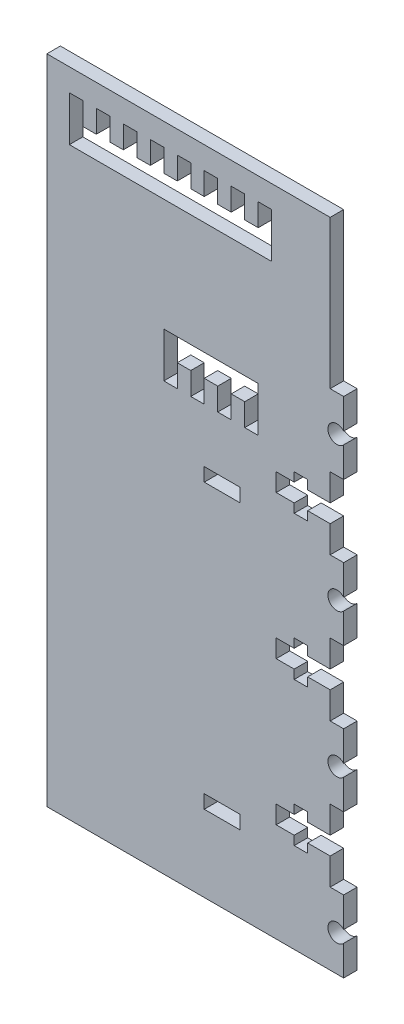
from build123d import *

# Parameters (mm, degrees)
SKETCH_1_W      = 8
SKETCH_1_H      = 3
EXTRUDE_1_DEPTH = 3


with BuildPart() as part:
    # 草图1 → 凸台-拉伸1 (new body)
    with BuildSketch(Plane.XY):
        with BuildLine():
            Line((63, 10), (63, 16))
            Line((63, 16), (66, 16))
            Line((66, 16), (66, 22.677124344))
            ThreePointArc((66, 22.677124344), (62.5, 24), (66, 25.322875656))
            Line((66, 25.322875656), (66, 32))
            Line((66, 32), (63, 32))
            Line((63, 32), (63, 38))
            Line((63, 38), (58, 38))
            Line((58, 38), (58, 36))
            Line((58, 36), (55, 36))
            Line((55, 36), (55, 38))
            Line((55, 38), (51, 38))
            Line((51, 38), (51, 42))
            Line((51, 42), (55, 42))
            Line((55, 42), (55, 44))
            Line((55, 44), (58, 44))
            Line((58, 44), (58, 42))
            Line((58, 42), (63, 42))
            Line((63, 42), (63, 48))
            Line((63, 48), (66, 48))
            Line((66, 48), (66, 54.677124344))
            ThreePointArc((66, 54.677124344), (62.5, 56), (66, 57.322875656))
            Line((66, 57.322875656), (66, 64))
            Line((66, 64), (63, 64))
            Line((63, 64), (63, 70))
            Line((63, 70), (58, 70))
            Line((58, 70), (58, 68))
            Line((58, 68), (55, 68))
            Line((55, 68), (55, 70))
            Line((55, 70), (51, 70))
            Line((51, 70), (51, 74))
            Line((51, 74), (55, 74))
            Line((55, 74), (55, 76))
            Line((55, 76), (58, 76))
            Line((58, 76), (58, 74))
            Line((58, 74), (63, 74))
            Line((63, 74), (63, 80))
            Line((63, 80), (66, 80))
            Line((66, 80), (66, 86.677124344))
            ThreePointArc((66, 86.677124344), (62.5, 88), (66, 89.322875656))
            Line((66, 89.322875656), (66, 96))
            Line((66, 96), (63, 96))
            Line((63, 96), (63, 129))
            Line((63, 129), (0, 129))
            Line((0, 129), (0, 0))
            Line((0, 0), (0, -16))
            Line((0, -16), (66, -16))
            Line((66, -16), (66, -9.322875656))
            ThreePointArc((66, -9.322875656), (62.5, -8), (66, -6.677124344))
            Line((66, -6.677124344), (66, 0))
            Line((66, 0), (63, 0))
            Line((63, 0), (63, 6))
            Line((63, 6), (58, 6))
            Line((58, 6), (58, 4))
            Line((58, 4), (55, 4))
            Line((55, 4), (55, 6))
            Line((55, 6), (51, 6))
            Line((51, 6), (51, 10))
            Line((51, 10), (55, 10))
            Line((55, 10), (55, 12))
            Line((55, 12), (58, 12))
            Line((58, 12), (58, 10))
            Line((58, 10), (63, 10))
        make_face()
        with Locations((39, 2.5)):
            Rectangle(SKETCH_1_W, SKETCH_1_H, mode=Mode.SUBTRACT)
        with Locations((39, 65.5)):
            Rectangle(SKETCH_1_W, SKETCH_1_H, mode=Mode.SUBTRACT)
        Polygon((47, 89), (47, 84), (47, 79), (44, 79), (44, 84), (41, 84), (41, 79), (38, 79), (38, 84), (35, 84), (35, 79), (32, 79), (32, 84), (29, 84), (29, 79), (26, 79), (26, 89), (32, 89), align=None, mode=Mode.SUBTRACT)
        Polygon((5, 114), (5, 124), (8, 124), (8, 119), (11, 119), (11, 124), (14, 124), (14, 119), (17, 119), (17, 124), (20, 124), (20, 119), (23, 119), (23, 124), (26, 124), (26, 119), (29, 119), (29, 124), (32, 124), (32, 119), (35, 119), (35, 124), (38, 124), (38, 119), (41, 119), (41, 124), (44, 124), (44, 119), (47, 119), (47, 124), (50, 124), (50, 114), align=None, mode=Mode.SUBTRACT)
    extrude(amount=EXTRUDE_1_DEPTH)


solid = part.part
